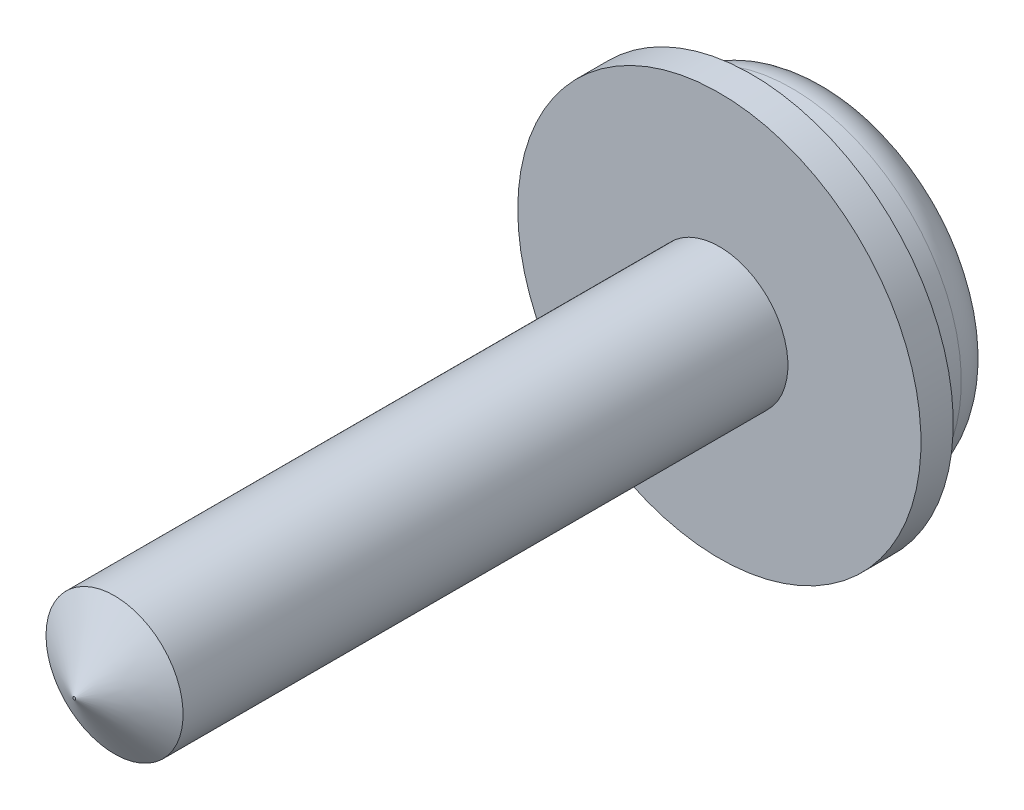
from build123d import *

# Parameters (mm, degrees)
ESBO_O1_R                = 0.85
RESSALTO_EXTRUS_O1_DEPTH = 8
CHANFRO1_SIZE            = 0.5
CHANFRO1_SIZE2           = 0.832139741
ESBO_O2_R                = 2.5
RESSALTO_EXTRUS_O2_DEPTH = 0.4
ESBO_O3_R                = 2.1
RESSALTO_EXTRUS_O3_DEPTH = 1
FILETE1_R                = 0.5
CORTE_EXTRUS_O1_DEPTH    = 1


with BuildPart() as part:
    # Esboço1 → Ressalto-extrusão1 (new body)
    with BuildSketch(Plane.XY):
        Circle(ESBO_O1_R)
    extrude(amount=RESSALTO_EXTRUS_O1_DEPTH)

    # Chanfro1
    chanfro1_edges = [part.edges().sort_by_distance(p)[0] for p in [
        (-0.85, 0, 8),
    ]]
    chanfro1_side = [part.faces().sort_by_distance(p)[0] for p in [
        (-0.85, 0, 4),
    ]]
    chamfer(chanfro1_edges, length=CHANFRO1_SIZE, length2=CHANFRO1_SIZE2, reference=chanfro1_side[0])

    # Esboço2 → Ressalto-extrusão2 (add)
    with BuildSketch(Plane(origin=(0, 0, 0), x_dir=(-1, 0, 0), z_dir=(0, 0, -1))):
        Circle(ESBO_O2_R)
    extrude(amount=RESSALTO_EXTRUS_O2_DEPTH)

    # Esboço3 → Ressalto-extrusão3 (add)
    with BuildSketch(Plane(origin=(0, 0, -0.4), x_dir=(-1, 0, 0), z_dir=(0, 0, -1))):
        Circle(ESBO_O3_R)
    extrude(amount=RESSALTO_EXTRUS_O3_DEPTH)

    # Filete1
    filete1_edges = [part.edges().sort_by_distance(p)[0] for p in [
        (2.1, 0, -1.4),
    ]]
    fillet(filete1_edges, radius=FILETE1_R)

    # Esboço4 → Corte-extrusão1 (cut)
    with BuildSketch(Plane(origin=(0, 0, -1.4), x_dir=(-1, 0, 0), z_dir=(0, 0, -1))):
        with BuildLine():
            Line((-0.6, 0.3), (-1.15, 0.3))
            Line((-1.15, 0.3), (-1.15, -0.3))
            Line((-1.15, -0.3), (-0.6, -0.3))
            ThreePointArc((-0.6, -0.3), (-0.387867966, -0.387867966), (-0.3, -0.6))
            Line((-0.3, -0.6), (-0.3, -1.15))
            Line((-0.3, -1.15), (0.3, -1.15))
            Line((0.3, -1.15), (0.3, -0.6))
            ThreePointArc((0.3, -0.6), (0.387867966, -0.387867966), (0.6, -0.3))
            Line((0.6, -0.3), (1.15, -0.3))
            Line((1.15, -0.3), (1.15, 0.3))
            Line((1.15, 0.3), (0.6, 0.3))
            ThreePointArc((0.6, 0.3), (0.387867966, 0.387867966), (0.3, 0.6))
            Line((0.3, 0.6), (0.3, 1.15))
            Line((0.3, 1.15), (-0.3, 1.15))
            Line((-0.3, 1.15), (-0.3, 0.6))
            ThreePointArc((-0.3, 0.6), (-0.387867966, 0.387867966), (-0.6, 0.3))
        make_face()
    extrude(amount=-CORTE_EXTRUS_O1_DEPTH, mode=Mode.SUBTRACT)


solid = part.part
